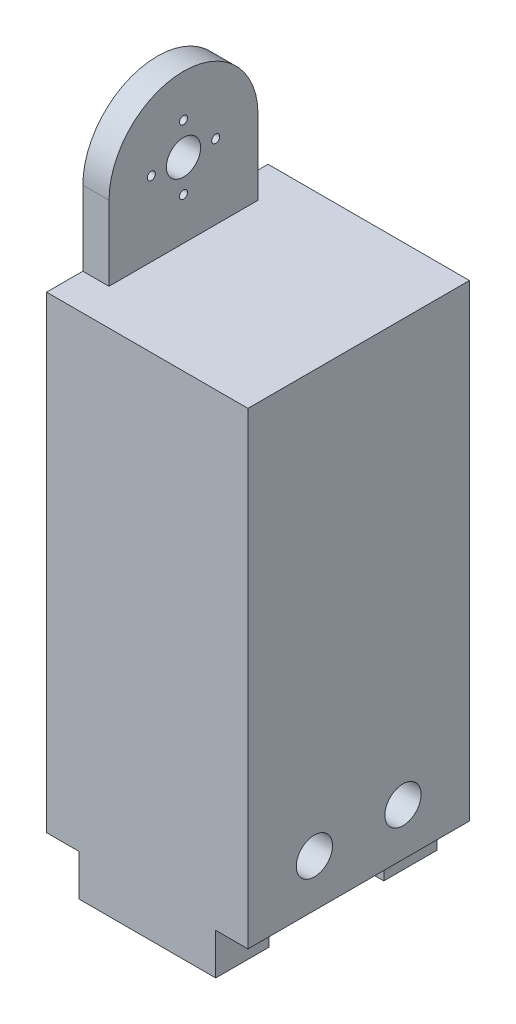
from build123d import *

# Parameters (mm, degrees)
SKETCH1_W               = 50
SKETCH1_H               = 150
BOSS_EXTRUDE1_DEPTH     = 55
CUT_EXTRUDE1_DEPTH      = 168.406690428
CUT_EXTRUDE1_DEPTH_BACK = 45
SKETCH2_R               = 10.25
SKETCH7_R               = 1
SKETCH7_R_2             = 4.25
CUT_EXTRUDE3_DEPTH      = 10
SKETCH8_W               = 55
SKETCH8_H               = 55
SKETCH8_R               = 10.25
BOSS_EXTRUDE2_DEPTH     = 50
SKETCH10_W              = 8
SKETCH10_H              = 10.25
SKETCH10_W_2            = 17
SKETCH10_H_2            = 1
SKETCH10_W_3            = 34
SKETCH10_H_3            = 20
SKETCH10_H_4            = 5
CUT_EXTRUDE4_DEPTH      = 214.717102732
SKETCH11_W              = 34
SKETCH11_H              = 13.25
BOSS_EXTRUDE4_DEPTH     = 25
SKETCH13_W              = 55
SKETCH13_H              = 10
CUT_EXTRUDE5_DEPTH      = 8
SKETCH14_R              = 5.030159043
CUT_EXTRUDE6_DEPTH      = 8
SKETCH15_W              = 34
SKETCH15_H              = 0.25
BOSS_EXTRUDE5_DEPTH     = 13.25
CUT_EXTRUDE7_DEPTH      = 181.416185527
BOSS_EXTRUDE6_START     = 1.5
SKETCH19_R              = 10.25
SKETCH19_R_2            = 1
SKETCH19_R_3            = 4.25
BOSS_EXTRUDE6_DEPTH     = 1.5
CUT_EXTRUDE8_DEPTH      = 184.89467094
SKETCH21_R              = 5.030159043
SKETCH21_R_2            = 4.5
BOSS_EXTRUDE7_DEPTH     = 8


with BuildPart() as part:
    # Sketch1 → Boss-Extrude1 (new body)
    with BuildSketch(Plane.XY):
        with Locations((0, -75)):
            Rectangle(SKETCH1_W, SKETCH1_H)
    extrude(amount=-BOSS_EXTRUDE1_DEPTH)

    # Sketch2 → Cut-Extrude1 (cut, two sides: drawn at the far end of the back side and taken through both)
    with BuildSketch(Plane(origin=(25, 0, 0), x_dir=(0, 0, -1), z_dir=(1, 0, 0)).offset(-CUT_EXTRUDE1_DEPTH_BACK)):
        with Locations(Location((27.5, -25, 0), (0, 0, 270))):
            Circle(SKETCH2_R)
    extrude(amount=CUT_EXTRUDE1_DEPTH + CUT_EXTRUDE1_DEPTH_BACK, mode=Mode.SUBTRACT)

    # Sketch7 → Cut-Extrude3 (cut)
    with BuildSketch(Plane(origin=(-20, 0, 0), x_dir=(0, 0, -1), z_dir=(1, 0, 0))):
        with Locations(Location((27.5, -17, 0), (0, 0, 90))):
            Circle(SKETCH7_R)
        with Locations(Location((35.5, -25, 0), (0, 0, 90))):
            Circle(SKETCH7_R)
        with Locations(Location((27.5, -33, 0), (0, 0, 90))):
            Circle(SKETCH7_R)
        with Locations(Location((19.5, -25, 0), (0, 0, 90))):
            Circle(SKETCH7_R)
        with Locations(Location((27.5, -25, 0), (0, 0, 90))):
            Circle(SKETCH7_R_2)
    extrude(amount=-CUT_EXTRUDE3_DEPTH, mode=Mode.SUBTRACT)

    # Sketch8 → Boss-Extrude2 (add)
    with BuildSketch(Plane(origin=(25, 0, 0), x_dir=(0, 0, -1), z_dir=(1, 0, 0))):
        with Locations((27.5, -177.5)):
            Rectangle(SKETCH8_W, SKETCH8_H)
        with Locations(Location((27.5, -180, 0), (0, 0, 90))):
            Circle(SKETCH8_R, mode=Mode.SUBTRACT)
    extrude(amount=-BOSS_EXTRUDE2_DEPTH)

    # Sketch10 → Cut-Extrude4 (cut, through all)
    with BuildSketch(Plane.XY):
        Polygon((-17, -205), (17, -205), (17, -191.25), (0, -191.25), (-17, -191.25), align=None)
        Polygon((-25, -205), (-17, -205), (-17, -191.25), (-17, -190.25), (-25, -190.25), align=None)
        Polygon((17, -191.25), (17, -205), (25, -205), (25, -190.25), (17, -190.25), align=None)
        with Locations((-21, -185.125)):
            Rectangle(SKETCH10_W, SKETCH10_H)
        with Locations((-21, -174.875)):
            Rectangle(SKETCH10_W, SKETCH10_H)
        with Locations((21, -174.875)):
            Rectangle(SKETCH10_W, SKETCH10_H)
        with Locations((21, -185.125)):
            Rectangle(SKETCH10_W, SKETCH10_H)
        with Locations((-8.5, -185.125)):
            Rectangle(SKETCH10_W_2, SKETCH10_H)
        with Locations((8.5, -185.125)):
            Rectangle(SKETCH10_W_2, SKETCH10_H)
        Polygon((0, -180), (17, -180), (17, -169.75), (-17, -169.75), (-17, -180), align=None)
        with Locations((-8.5, -190.75)):
            Rectangle(SKETCH10_W_2, SKETCH10_H_2)
        with Locations((8.5, -190.75)):
            Rectangle(SKETCH10_W_2, SKETCH10_H_2)
        with Locations((0, -154.75)):
            Rectangle(SKETCH10_W_3, SKETCH10_H_3)
        with Locations((0, -167.25)):
            Rectangle(SKETCH10_W_3, SKETCH10_H_4)
    extrude(amount=-CUT_EXTRUDE4_DEPTH, mode=Mode.SUBTRACT)

    # Sketch11 → Boss-Extrude4 (add)
    with BuildSketch(Plane.XZ.offset(144.75)):
        with Locations((0, -6.625)):
            Rectangle(SKETCH11_W, SKETCH11_H)
        with Locations((0, -48.375)):
            Rectangle(SKETCH11_W, SKETCH11_H)
    extrude(amount=BOSS_EXTRUDE4_DEPTH)

    # Sketch13 → Cut-Extrude5 (cut)
    with BuildSketch(Plane(origin=(25, 0, 0), x_dir=(0, 0, -1), z_dir=(1, 0, 0))):
        with Locations((27.5, -164.75)):
            Rectangle(SKETCH13_W, SKETCH13_H)
    cut_extrude5 = extrude(amount=-CUT_EXTRUDE5_DEPTH, mode=Mode.SUBTRACT)

    # Mirror2: Cut-Extrude5 across plane
    add(cut_extrude5.mirror(Plane(origin=(0, 0, 0), x_dir=(0, 0, 1), z_dir=(1, 0, 0))), mode=Mode.SUBTRACT)

    # Sketch14 → Cut-Extrude6 (cut)
    with BuildSketch(Plane(origin=(25, 0, 0), x_dir=(0, 0, -1), z_dir=(1, 0, 0))):
        with Locations(Location((16.5, -148, 0), (0, 0, 90))):
            Circle(SKETCH14_R)
        with Locations(Location((38.5, -148, 0), (0, 0, 90))):
            Circle(SKETCH14_R)
    cut_extrude6 = extrude(amount=-CUT_EXTRUDE6_DEPTH, mode=Mode.SUBTRACT)

    # Mirror3: Cut-Extrude6 across plane
    add(cut_extrude6.mirror(Plane(origin=(0, 0, 0), x_dir=(0, 0, 1), z_dir=(1, 0, 0))), mode=Mode.SUBTRACT)

    # Sketch15 → Boss-Extrude5 (add)
    with BuildSketch(Plane.XY):
        with Locations((0, -169.875)):
            Rectangle(SKETCH15_W, SKETCH15_H)
    boss_extrude5 = extrude(amount=-BOSS_EXTRUDE5_DEPTH)

    # Mirror4: Boss-Extrude5 across plane
    add(boss_extrude5.mirror(Plane.XY.offset(-27.5)))

    # Sketch16 → Cut-Extrude7 (cut, through all)
    with BuildSketch(Plane.XY):
        Polygon((-18.5, 0), (-18.5, -14.75), (-18.5, -35.25), (-18.5, -43.5), (25, -43.5), (25, 0), align=None)
    extrude(amount=-CUT_EXTRUDE7_DEPTH, mode=Mode.SUBTRACT)

    # Sketch19 → Boss-Extrude6 (add)
    with BuildSketch(Plane(origin=(-20, 0, 0), x_dir=(0, 0, -1), z_dir=(1, 0, 0)).offset(BOSS_EXTRUDE6_START)):
        with Locations((27.5, -25)):
            Circle(SKETCH19_R)
        with Locations(Location((27.5, -17, 0), (0, 0, 90))):
            Circle(SKETCH19_R_2, mode=Mode.SUBTRACT)
        with Locations(Location((27.5, -33, 0), (0, 0, 90))):
            Circle(SKETCH19_R_2, mode=Mode.SUBTRACT)
        with Locations(Location((19.5, -25, 0), (0, 0, 90))):
            Circle(SKETCH19_R_2, mode=Mode.SUBTRACT)
        with Locations(Location((35.5, -25, 0), (0, 0, 90))):
            Circle(SKETCH19_R_2, mode=Mode.SUBTRACT)
        with Locations(Location((27.5, -25, 0), (0, 0, 90))):
            Circle(SKETCH19_R_3, mode=Mode.SUBTRACT)
    extrude(amount=-BOSS_EXTRUDE6_DEPTH)

    # Sketch20 → Cut-Extrude8 (cut, through all)
    with BuildSketch(Plane(origin=(-18.5, 0, 0), x_dir=(0, 0, -1), z_dir=(1, 0, 0))):
        with BuildLine():
            Line((0, 0), (0, -43.5))
            Line((0, -43.5), (9, -43.5))
            Line((9, -43.5), (9, -25))
            ThreePointArc((9, -25), (27.5, -6.5), (46, -25))
            Line((46, -25), (46, -43.5))
            Line((46, -43.5), (55, -43.5))
            Line((55, -43.5), (55, 0))
            Line((55, 0), (0, 0))
        make_face()
    extrude(amount=-CUT_EXTRUDE8_DEPTH, mode=Mode.SUBTRACT)

    # Sketch21 → Boss-Extrude7 (add)
    # profile 1 of 2: a face of its own
    with BuildSketch(Plane(origin=(25, 0, 0), x_dir=(0, 0, -1), z_dir=(1, 0, 0))):
        with Locations(Location((16.5, -148, 0), (0, 0, 229.751587581))):
            Circle(SKETCH21_R)
        with Locations(Location((16.5, -148, 0), (0, 0, 90))):
            Circle(SKETCH21_R_2, mode=Mode.SUBTRACT)
    # profile 2 of 2: a face of its own
    with BuildSketch(Plane(origin=(25, 0, 0), x_dir=(0, 0, -1), z_dir=(1, 0, 0))):
        with Locations(Location((38.5, -148, 0), (0, 0, 310.248412419))):
            Circle(SKETCH21_R)
        with Locations(Location((38.5, -148, 0), (0, 0, 90))):
            Circle(SKETCH21_R_2, mode=Mode.SUBTRACT)
    boss_extrude7 = extrude(amount=-BOSS_EXTRUDE7_DEPTH)

    # Mirror5: Boss-Extrude7 across plane
    add(boss_extrude7.mirror(Plane(origin=(0, 0, 0), x_dir=(0, 0, 1), z_dir=(1, 0, 0))))


solid = part.part
